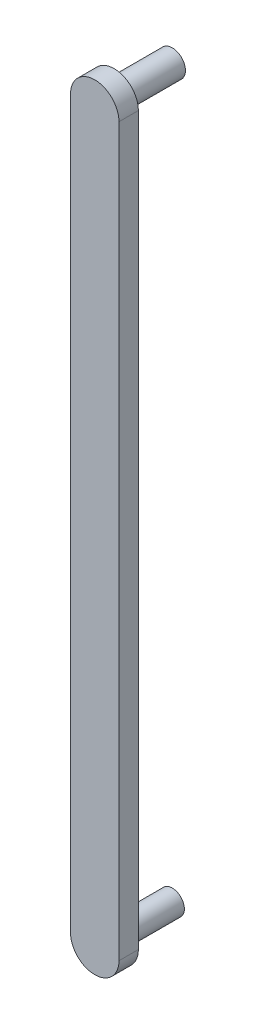
from build123d import *

# Parameters (mm, degrees)
SKETCH1_R           = 1.5875
BOSS_EXTRUDE1_DEPTH = 2.54
BOSS_EXTRUDE2_START = -10.16
SKETCH2_R           = 1.72979554
SKETCH2_R_2         = 1.5875
BOSS_EXTRUDE2_DEPTH = 10.16


with BuildPart() as part:
    # Sketch1 → Boss-Extrude1 (new body)
    with BuildSketch(Plane.XY):
        with BuildLine():
            Line((-3.175, 0), (-3.175, -95.25))
            ThreePointArc((-3.175, -95.25), (0, -98.425), (3.175, -95.25))
            Line((3.175, -95.25), (3.175, 0))
            ThreePointArc((3.175, 0), (0, 3.175), (-3.175, 0))
        make_face()
        Circle(SKETCH1_R, mode=Mode.SUBTRACT)
        with Locations((0, -95.25)):
            Circle(SKETCH1_R, mode=Mode.SUBTRACT)
    extrude(amount=BOSS_EXTRUDE1_DEPTH)

    # Sketch2 → Boss-Extrude2 (add)
    with BuildSketch(Plane.XY.offset(2.54).offset(BOSS_EXTRUDE2_START)):
        Circle(SKETCH2_R)
        with Locations((0, -95.25)):
            Circle(SKETCH2_R_2)
    extrude(amount=BOSS_EXTRUDE2_DEPTH)


solid = part.part
